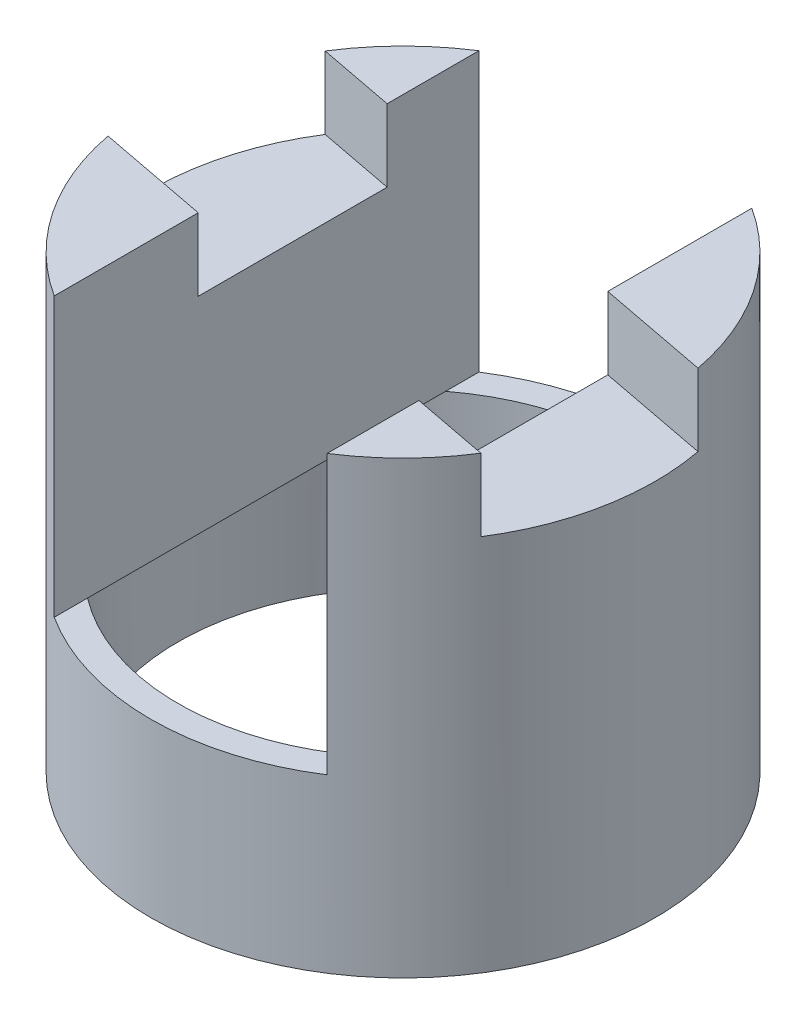
from build123d import *

# Parameters (mm, degrees)
SKETCH1_R           = 18.5
BOSS_EXTRUDE1_DEPTH = 33
SKETCH4_R           = 16.5
CUT_EXTRUDE3_DEPTH  = 12.6
SKETCH5_W           = 20
SKETCH5_H           = 49.349350968
CUT_EXTRUDE4_DEPTH  = 20.4
SKETCH7_W           = 56.502792025
SKETCH7_H           = 7.03676062
CUT_EXTRUDE5_DEPTH  = 6.8


with BuildPart() as part:
    # Sketch1 → Boss-Extrude1 (new body)
    with BuildSketch(Plane(origin=(0, 0, 0), x_dir=(1, 0, 0), z_dir=(0, 1, 0))):
        with Locations(Location((0, 0, 0), (0, 0, 270))):
            Circle(SKETCH1_R)
    extrude(amount=BOSS_EXTRUDE1_DEPTH)

    # Sketch4 → Cut-Extrude3 (cut)
    with BuildSketch(Plane.XZ):
        with Locations(Location((0, 0, 0), (0, 0, 270))):
            Circle(SKETCH4_R)
    extrude(amount=-CUT_EXTRUDE3_DEPTH, mode=Mode.SUBTRACT)

    # Sketch5 → Cut-Extrude4 (cut)
    with BuildSketch(Plane(origin=(0, 33, 0), x_dir=(1, 0, 0), z_dir=(0, 1, 0))):
        Rectangle(SKETCH5_W, SKETCH5_H)
    extrude(amount=-CUT_EXTRUDE4_DEPTH, mode=Mode.SUBTRACT)

    # Sketch7 → Cut-Extrude5 (cut, symmetric)
    with BuildSketch(Plane(origin=(0, 0, 0), x_dir=(0.9821726027310876, 0, 0.1879813247225403), z_dir=(-0.1879813247225403, 0, 0.9821726027310876))):
        with Locations((-1.059105512, 31.21838031)):
            Rectangle(SKETCH7_W, SKETCH7_H)
    extrude(amount=CUT_EXTRUDE5_DEPTH, both=True, mode=Mode.SUBTRACT)


solid = part.part
